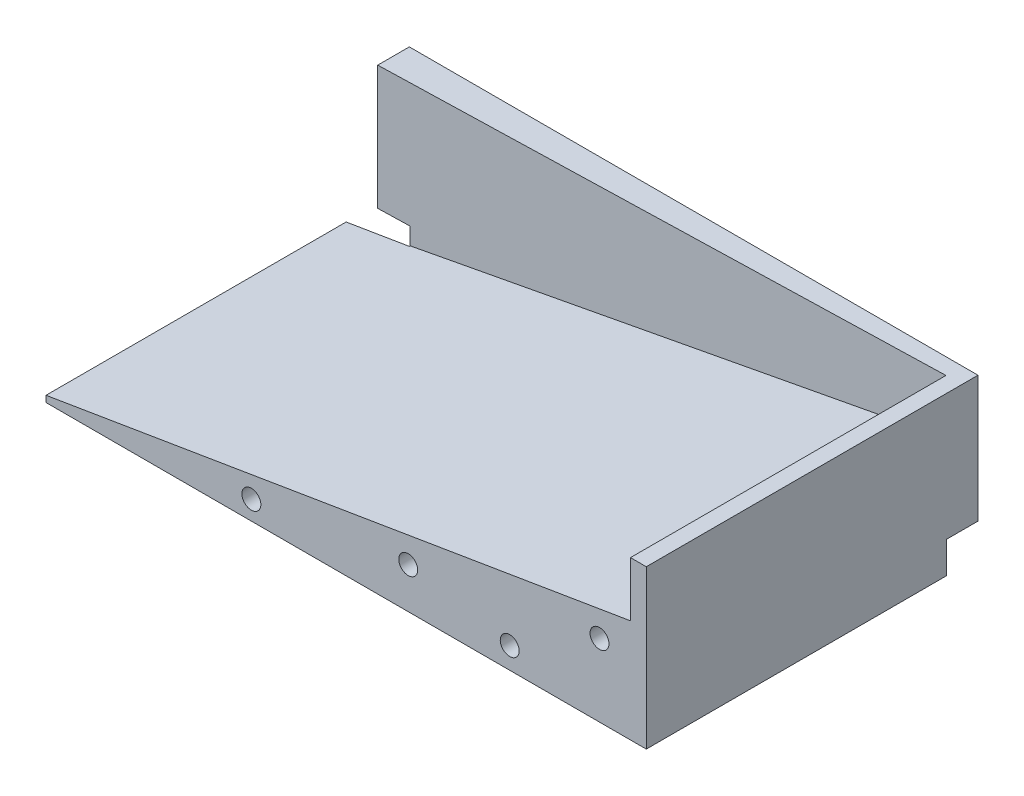
from build123d import *

# Parameters (mm, degrees)
ESQUISSE1_R             = 3
BOSS_EXTRU_1_DEPTH      = 200
ESQUISSE4_W             = 5
ESQUISSE4_H             = 50
BOSS_EXTRU_4_DEPTH      = 180
BOSS_EXTRU_7_DEPTH      = 50
ESQUISSE6_W             = 20
ESQUISSE6_H             = 10.719834163
ENL_V_MAT_EXTRU_2_DEPTH = 10
ESQUISSE5_W             = 10
ESQUISSE5_H             = 10
ENL_V_MAT_EXTRU_1_DEPTH = 10
ESQUISSE14_R            = 5
ENL_V_MAT_EXTRU_4_DEPTH = 15
BOSS_EXTRU_8_REACH      = 242.401
ESQUISSE16_W            = 219.108996988
ESQUISSE16_H            = 68.482817494
ENL_V_MAT_EXTRU_5_DEPTH = 105


with BuildPart() as part:
    # Esquisse1 → Boss.-Extru.1 (new body)
    with BuildSketch(Plane.XY):
        Polygon((-105.796013405, 0), (84.203986595, 0), (84.203986595, 33.502126335), (-105.796013405, 2), align=None)
        with Locations((69.406004871, 22.939397164)):
            Circle(ESQUISSE1_R, mode=Mode.SUBTRACT)
        with Locations((40.981469067, 6.77616521)):
            Circle(ESQUISSE1_R, mode=Mode.SUBTRACT)
        with Locations((-40.796013405, 6)):
            Circle(ESQUISSE1_R, mode=Mode.SUBTRACT)
        with Locations((8.861542866, 12.901085106)):
            Circle(ESQUISSE1_R, mode=Mode.SUBTRACT)
    extrude(amount=BOSS_EXTRU_1_DEPTH)

    # Esquisse4 → Boss.-Extru.4 (add)
    with BuildSketch(Plane(origin=(84.203986595, 0, 0), x_dir=(0, 0, -1), z_dir=(1, 0, 0))):
        with Locations((-202.5, 25)):
            Rectangle(ESQUISSE4_W, ESQUISSE4_H)
        with Locations((2.5, 25)):
            Rectangle(ESQUISSE4_W, ESQUISSE4_H)
    extrude(amount=-BOSS_EXTRU_4_DEPTH)

    # Esquisse8 → Boss.-Extru.7 (add)
    with BuildSketch(Plane(origin=(0, 50, 0), x_dir=(1, 0, 0), z_dir=(0, 1, 0))):
        Polygon((84.203986595, 0), (-95.796013405, 0), (-95.796013405, -5), align=None)
    boss_extru_7 = extrude(amount=-BOSS_EXTRU_7_DEPTH)

    # Esquisse6 → Enlèv. mat.-Extru.2 (cut)
    with BuildSketch(Plane(origin=(0, 0, -5), x_dir=(-1, 0, 0), z_dir=(0, 0, -1))):
        with Locations((95.796013405, 5.359917081)):
            Rectangle(ESQUISSE6_W, ESQUISSE6_H)
    enl_v_mat_extru_2 = extrude(amount=-ENL_V_MAT_EXTRU_2_DEPTH, mode=Mode.SUBTRACT)

    # Esquisse5 → Enlèv. mat.-Extru.1 (cut)
    with BuildSketch(Plane(origin=(84.203986595, 0, 0), x_dir=(0, 0, -1), z_dir=(1, 0, 0))):
        with Locations((-200, 5)):
            Rectangle(ESQUISSE5_W, ESQUISSE5_H)
        with Locations((0, 5)):
            Rectangle(ESQUISSE5_W, ESQUISSE5_H)
    extrude(amount=-ENL_V_MAT_EXTRU_1_DEPTH, mode=Mode.SUBTRACT)

    # Esquisse14 → Enlèv. mat.-Extru.4 (cut)
    with BuildSketch(Plane(origin=(0, 0, -5), x_dir=(-1, 0, 0), z_dir=(0, 0, -1))):
        with Locations((-69.406004871, 22.939397164)):
            Circle(ESQUISSE14_R)
        with Locations((-40.981469067, 6.77616521)):
            Circle(ESQUISSE14_R)
        with Locations((-8.861542866, 12.901085106)):
            Circle(ESQUISSE14_R)
        with Locations((40.796013405, 6)):
            Circle(ESQUISSE14_R)
    enl_v_mat_extru_4 = extrude(amount=-ENL_V_MAT_EXTRU_4_DEPTH, mode=Mode.SUBTRACT)

    # Symétrie3: Boss.-Extru.7, Enlèv. mat.-Extru.2, Enlèv. mat.-Extru.4 across plane
    add(boss_extru_7.mirror(Plane(origin=(0, 0, 100), x_dir=(1, 0, 0), z_dir=(0, 0, -1))))
    add(enl_v_mat_extru_2.mirror(Plane(origin=(0, 0, 100), x_dir=(1, 0, 0), z_dir=(0, 0, -1))), mode=Mode.SUBTRACT)
    add(enl_v_mat_extru_4.mirror(Plane(origin=(0, 0, 100), x_dir=(1, 0, 0), z_dir=(0, 0, -1))), mode=Mode.SUBTRACT)

    # Boss.-Extru.8: up to this plane
    boss_extru_8_end = Plane(origin=(-95.796013405, -180.069431054, 195), z_dir=(-0.0277670672403533, 0, 0.9996144206527183))
    # Esquisse15 → Boss.-Extru.8 (add, up to the surface)
    with BuildSketch(Plane(origin=(0, 0, -5), x_dir=(-1, 0, 0), z_dir=(0, 0, -1)), mode=Mode.PRIVATE) as boss_extru_8_sk1:
        Polygon((-84.203986595, 33.502126335), (-79.203986595, 32.67312301), (-79.203986595, 50), (-84.203986595, 50), align=None)
    boss_extru_8_tool1 = split(extrude(boss_extru_8_sk1.sketch, amount=-BOSS_EXTRU_8_REACH, mode=Mode.PRIVATE), bisect_by=boss_extru_8_end, keep=Keep.BOTH, mode=Mode.PRIVATE)
    add(boss_extru_8_tool1.solids().sort_by_distance((81.683563, 41.542119, -5))[0])

    # Esquisse16 → Enlèv. mat.-Extru.5 (cut)
    with BuildSketch(Plane(origin=(0, 0, 100), x_dir=(-1, 0, 0), z_dir=(0, 0, -1))):
        with Locations((5.796013405, 28.916172848)):
            Rectangle(ESQUISSE16_W, ESQUISSE16_H)
    extrude(amount=-ENL_V_MAT_EXTRU_5_DEPTH, mode=Mode.SUBTRACT)


solid = part.part
